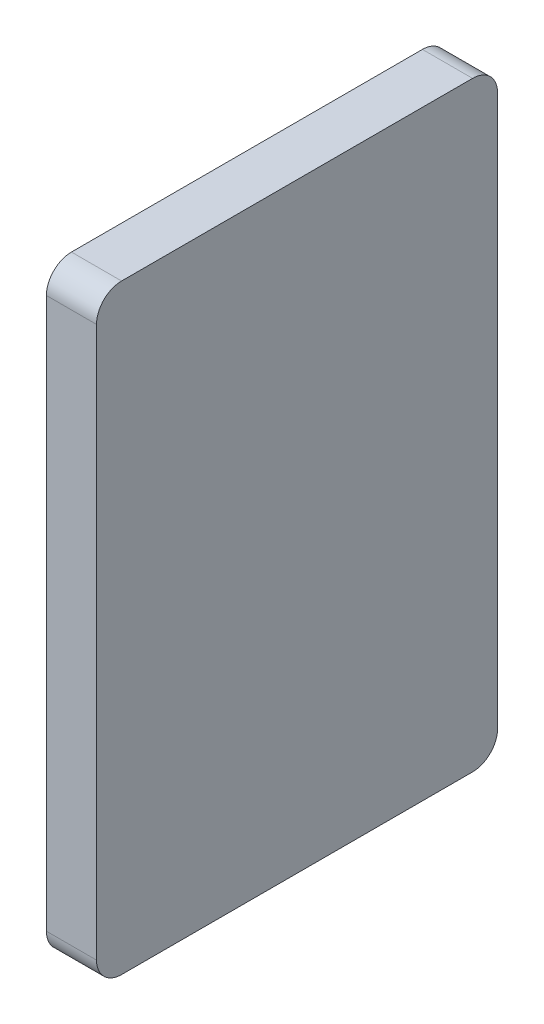
from build123d import *

# Parameters (mm, degrees)
BOSS_EXTRUDE1_START = 117.777002
SKETCH1_W           = 50.8
SKETCH1_H           = 76.073
BOSS_EXTRUDE1_DEPTH = 6.35
FILLET1_R           = 3.175


with BuildPart() as part:
    # Sketch1 → Boss-Extrude1 (new body)
    with BuildSketch(Plane(origin=(0, 0, 0), x_dir=(0, 0, -1), z_dir=(1, 0, 0)).offset(BOSS_EXTRUDE1_START)):
        with Locations((-1358.637834154, 119.568074554)):
            Rectangle(SKETCH1_W, SKETCH1_H)
    extrude(amount=BOSS_EXTRUDE1_DEPTH)

    # Fillet1
    fillet1_edges = [part.edges().sort_by_distance(p)[0] for p in [
        (120.952002, 81.531574554, 1333.237834154),
        (120.952002, 81.531574554, 1384.037834154),
        (120.952002, 157.604574554, 1384.037834154),
        (120.952002, 157.604574554, 1333.237834154),
    ]]
    fillet(fillet1_edges, radius=FILLET1_R)


solid = part.part
